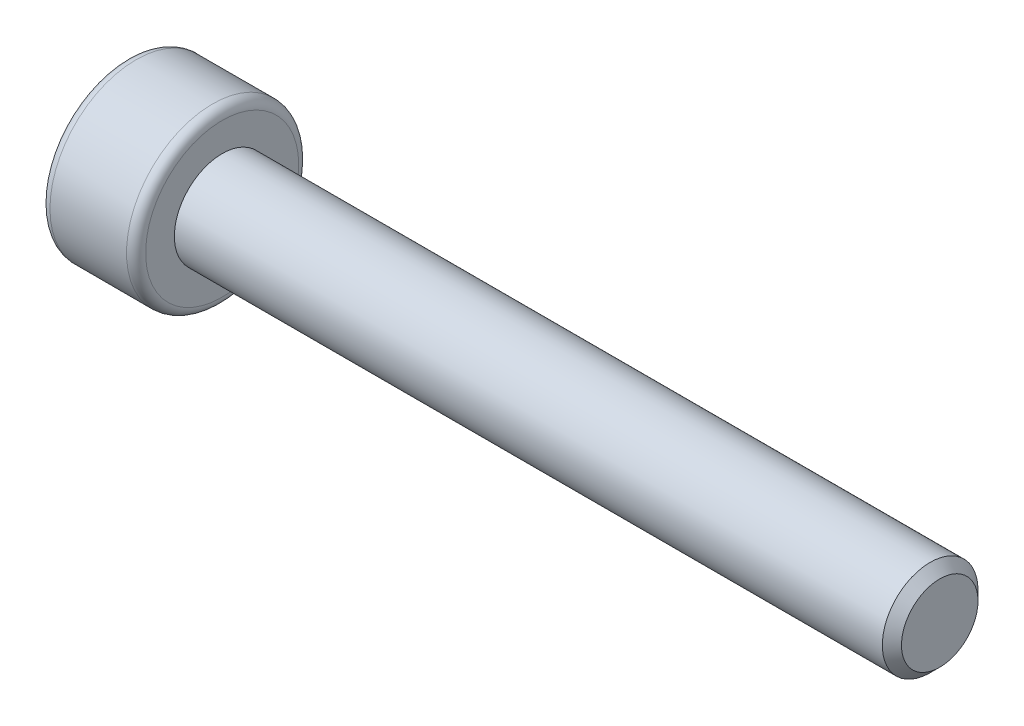
from build123d import *

# Parameters (mm, degrees)
CUT_EXTRUDE_1_DEPTH = 1.5
FILLET_1_R          = 0.2
CHAMFER_1_SIZE      = 0.2


with BuildPart() as part:
    # 草图1 → 旋转1 (revolve)
    with BuildSketch(Plane.XY, mode=Mode.PRIVATE) as revolve_1_sk:
        Polygon((-8.5, 0), (-8.5, 1.8), (-6.5, 1.8), (-6.5, 1), (8.5, 1), (8.5, 0), align=None)
    revolve(revolve_1_sk.sketch.rotate(Axis((8.5, 0, 0), (-1, 0, 0)), 90), axis=Axis((8.5, 0, 0), (-1, 0, 0)))

    # 草图2 → 切除-拉伸1 (cut)
    with BuildSketch(Plane.ZY.offset(8.5)):
        Polygon((0.866025404, 0), (0.433012702, 0.75), (-0.433012702, 0.75), (-0.866025404, 0), (-0.433012702, -0.75), (0.433012702, -0.75), align=None)
    extrude(amount=-CUT_EXTRUDE_1_DEPTH, mode=Mode.SUBTRACT)

    # 圆角1
    fillet_1_edges = [part.edges().sort_by_distance(p)[0] for p in [
        (-6.5, 0, 1.8),
        (-8.5, 0, 1.8),
    ]]
    fillet(fillet_1_edges, radius=FILLET_1_R)

    # 倒角1
    chamfer_1_edges = [part.edges().sort_by_distance(p)[0] for p in [
        (8.5, 0, 1),
    ]]
    chamfer(chamfer_1_edges, length=CHAMFER_1_SIZE)


solid = part.part
